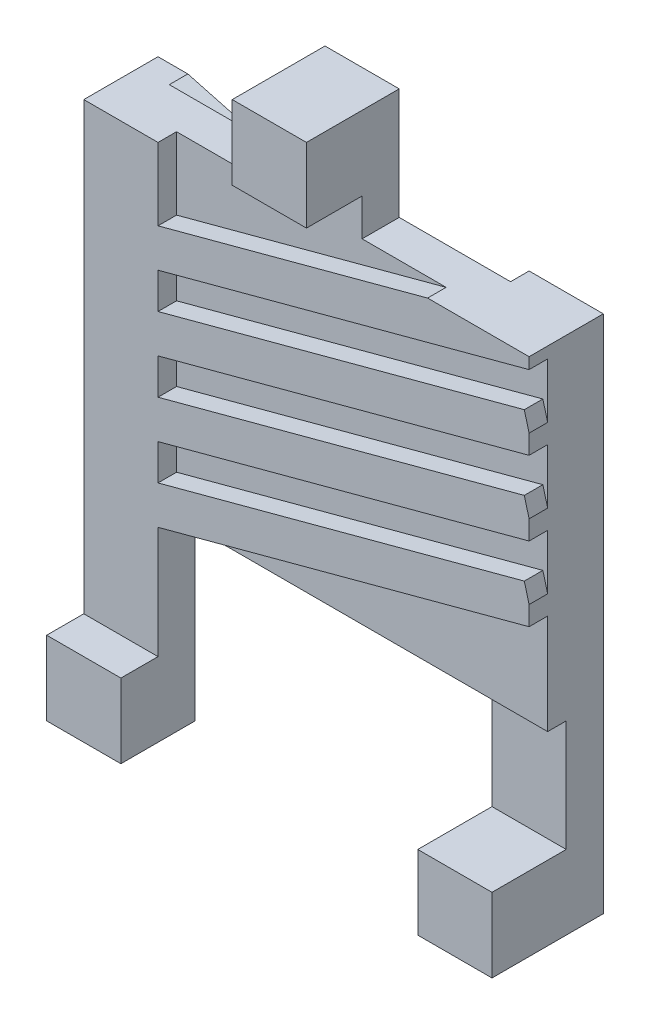
from build123d import *

# Parameters (mm, degrees)
BOSS_EXTRUDE1_DEPTH             = 0.05
BOSS_EXTRUDE1_DEPTH_BACK        = 0.05
SKETCH3_W                       = 1.2
SKETCH3_H                       = 0.9
BOSS_EXTRUDE2_REACH             = 3.845
SKETCH4_W                       = 0.2
SKETCH4_H                       = 0.3
BOSS_EXTRUDE2_DIRECTION_2_REACH = 3.845
EXTRUDE_THIN1_DEPTH             = 0.05
EXTRUDE_THIN2_DEPTH             = 0.05
LPATTERN1_COUNT                 = 4
LPATTERN1_PITCH                 = 0.2
CUT_EXTRUDE1_DEPTH              = 3.093734881
CUT_EXTRUDE1_DEPTH_BACK         = 3.093734881
SKETCH8_W                       = 0.2
SKETCH8_H                       = 1.4
BOSS_EXTRUDE3_DEPTH             = 0.1
SKETCH9_W                       = 0.2
SKETCH9_H                       = 1.4
BOSS_EXTRUDE4_DEPTH             = 0.1
SKETCH10_W                      = 0.2
SKETCH10_H                      = 0.2
BOSS_EXTRUDE5_DEPTH             = 0.2
SKETCH11_W                      = 0.2
SKETCH11_H                      = 0.2
BOSS_EXTRUDE6_DEPTH             = 0.2


with BuildPart() as part:
    # Sketch3 → Boss-Extrude1 (new, two sides: drawn at the far end of the back side and taken through both)
    with BuildSketch(Plane.XY.offset(-BOSS_EXTRUDE1_DEPTH_BACK)):
        with Locations((0.6, 0.95)):
            Rectangle(SKETCH3_W, SKETCH3_H)
    extrude(amount=BOSS_EXTRUDE1_DEPTH + BOSS_EXTRUDE1_DEPTH_BACK)

    # Boss-Extrude2: up to this face of the body (flat: up to its plane)
    boss_extrude2_end = Plane(part.part.faces().sort_by_distance((0.6, 0.95, 0.05))[0])
    # Sketch4 → Boss-Extrude2 (add, up to the picked face)
    with BuildSketch(Plane.XY, mode=Mode.PRIVATE) as boss_extrude2_sk1:
        with Locations((0.6, 1.55)):
            Rectangle(SKETCH4_W, SKETCH4_H)
    boss_extrude2_tool1 = split(extrude(boss_extrude2_sk1.sketch, amount=BOSS_EXTRUDE2_REACH, mode=Mode.PRIVATE), bisect_by=boss_extrude2_end, keep=Keep.BOTH, mode=Mode.PRIVATE)
    add(boss_extrude2_tool1.solids().sort_by(Axis((0.6, 1.55, 0), (0, 0, 1)))[0])

    # Boss-Extrude2 direction 2: up to this face of the body (flat: up to its plane)
    boss_extrude2_direction_2_end = Plane(part.part.faces().sort_by_distance((0.6, 0.95, -0.05))[0])
    # Sketch4 → Boss-Extrude2 direction 2 (add, up to the picked face)
    with BuildSketch(Plane.XY, mode=Mode.PRIVATE) as boss_extrude2_direction_2_sk1:
        with Locations((0.6, 1.55)):
            Rectangle(SKETCH4_W, SKETCH4_H)
    boss_extrude2_direction_2_tool1 = split(extrude(boss_extrude2_direction_2_sk1.sketch, amount=-BOSS_EXTRUDE2_DIRECTION_2_REACH, mode=Mode.PRIVATE), bisect_by=boss_extrude2_direction_2_end, keep=Keep.BOTH, mode=Mode.PRIVATE)
    add(boss_extrude2_direction_2_tool1.solids().sort_by(Axis((0.6, 1.55, 0), (0, 0, -1)))[0])

    # Sketch5 → Extrude-Thin1 (add)
    with BuildSketch(Plane.XY.offset(0.05)):
        Polygon((0.012940952, 0.451703709), (1.212940952, 0.77324274), (1.187059048, 0.869835322), (-0.012940952, 0.548296291), align=None)
    extrude_thin1 = extrude(amount=EXTRUDE_THIN1_DEPTH)

    # Sketch6 → Extrude-Thin2 (add)
    with BuildSketch(Plane(origin=(0, 0, -0.05), x_dir=(-1, 0, 0), z_dir=(0, 0, -1))):
        Polygon((-1.2, 0.5), (0, 0.821539031), (0.025881905, 0.724946448), (-1.174118095, 0.403407417), align=None)
    extrude_thin2 = extrude(amount=EXTRUDE_THIN2_DEPTH)

    # LPattern1: Extrude-Thin1, Extrude-Thin2 ×4
    with Locations(*[(0, i * LPATTERN1_PITCH, 0) for i in range(1, LPATTERN1_COUNT)]):
        add(extrude_thin1)
        add(extrude_thin2)

    # Sketch7 → Cut-Extrude1 (cut, two sides: drawn at the far end of the back side and taken through both)
    with BuildSketch(Plane.XY.offset(0.05).offset(-CUT_EXTRUDE1_DEPTH_BACK)):
        Polygon((0.5, 1.7), (0.5, 1.4), (0, 1.4), (0, 0.5), (0, 0.2), (-0.1, 0.2), (-0.1, 1.7), align=None)
        Polygon((1.2, 1.4), (1.2, 0.5), (1.2, 0.2), (1.3, 0.2), (1.3, 1.7), (0.7, 1.7), (0.7, 1.4), align=None)
    extrude(amount=CUT_EXTRUDE1_DEPTH + CUT_EXTRUDE1_DEPTH_BACK, mode=Mode.SUBTRACT)

    # Sketch8 → Boss-Extrude3 (add)
    with BuildSketch(Plane.XY):
        with Locations((0.1, 0.7)):
            Rectangle(SKETCH8_W, SKETCH8_H)
    extrude(amount=BOSS_EXTRUDE3_DEPTH)

    # Sketch9 → Boss-Extrude4 (add)
    with BuildSketch(Plane.XY):
        with Locations((1.1, 0.7)):
            Rectangle(SKETCH9_W, SKETCH9_H)
    extrude(amount=-BOSS_EXTRUDE4_DEPTH)

    # Sketch10 → Boss-Extrude5 (add)
    with BuildSketch(Plane.XY):
        with Locations((1.1, 0.1)):
            Rectangle(SKETCH10_W, SKETCH10_H)
        with Locations((0.1, 0.1)):
            Rectangle(SKETCH10_W, SKETCH10_H)
    extrude(amount=BOSS_EXTRUDE5_DEPTH)

    # Sketch11 → Boss-Extrude6 (add)
    with BuildSketch(Plane.XY):
        with Locations((0.6, 1.6)):
            Rectangle(SKETCH11_W, SKETCH11_H)
    extrude(amount=BOSS_EXTRUDE6_DEPTH)


solid = part.part
